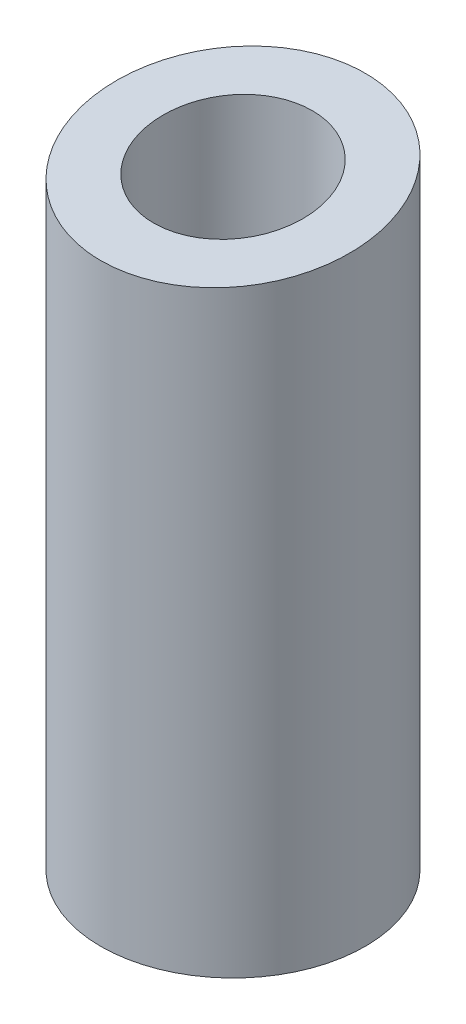
from build123d import *

# Parameters (mm, degrees)
SKETCH1_R               = 2.5
SKETCH1_R_2             = 1.5
BOSS_EXTRUDE1_DEPTH     = 13
CUT_EXTRUDE1_DEPTH      = 13
CUT_EXTRUDE1_DEPTH_BACK = 13


with BuildPart() as part:
    # Sketch1 → Boss-Extrude1 (new body)
    with BuildSketch(Plane(origin=(0, 0, 0), x_dir=(1, 0, 0), z_dir=(0, 1, 0))):
        Circle(SKETCH1_R)
        Circle(SKETCH1_R_2, mode=Mode.SUBTRACT)
    extrude(amount=BOSS_EXTRUDE1_DEPTH)

    # Sketch4 → Cut-Extrude1 (cut, two sides: drawn at the far end of the back side and taken through both)
    with BuildSketch(Plane(origin=(0, 0, 0), x_dir=(0, 0, -1), z_dir=(1, 0, 0)).offset(-CUT_EXTRUDE1_DEPTH_BACK)):
        Polygon((2.5, 11.79923267), (-2.5, 11.23), (-2.5, 13), (2.5, 13), align=None)
    extrude(amount=CUT_EXTRUDE1_DEPTH + CUT_EXTRUDE1_DEPTH_BACK, mode=Mode.SUBTRACT)


solid = part.part
